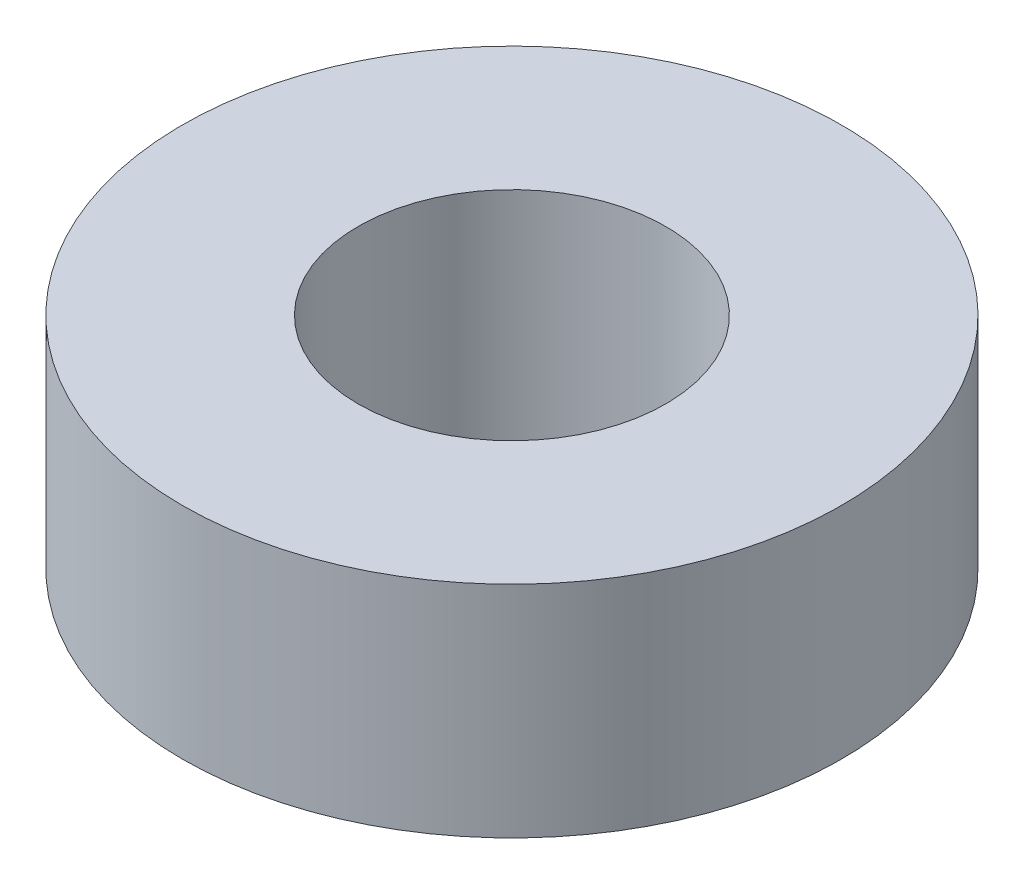
from build123d import *

# Parameters (mm, degrees)
SKETCH_1_R      = 7.5
SKETCH_1_R_2    = 3.5
EXTRUDE_1_DEPTH = 5


with BuildPart() as part:
    # 草图1 → 凸台-拉伸1 (new body)
    with BuildSketch(Plane(origin=(0, 0, 0), x_dir=(1, 0, 0), z_dir=(0, 1, 0))):
        with Locations(Location((0, 0, 0), (0, 0, 270))):
            Circle(SKETCH_1_R)
        with Locations(Location((0, 0, 0), (0, 0, 270))):
            Circle(SKETCH_1_R_2, mode=Mode.SUBTRACT)
    extrude(amount=EXTRUDE_1_DEPTH)


solid = part.part
